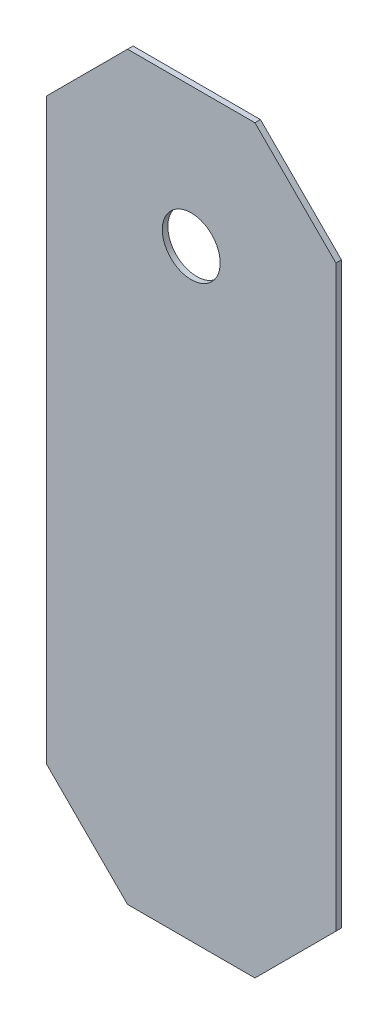
from build123d import *

# Parameters (mm, degrees)
SKETCH_1_R      = 21
EXTRUDE_1_DEPTH = 4


with BuildPart() as part:
    # Эскиз1 → Вытянуть1 (new body)
    with BuildSketch(Plane.XY):
        Polygon((-105, 539.996445798), (-105, 203.99388251), (-105, 161.99388251), (-46.222366275, 103.216248785), (46.222366275, 103.216248785), (105, 161.99388251), (105, 203.99388251), (105, 539.996445798), (105, 581.996445798), (46.222366275, 640.774079523), (-46.222366275, 640.774079523), (-105, 581.996445798), align=None)
        with Locations((0, 539.996445798)):
            Circle(SKETCH_1_R, mode=Mode.SUBTRACT)
    extrude(amount=EXTRUDE_1_DEPTH)


solid = part.part
